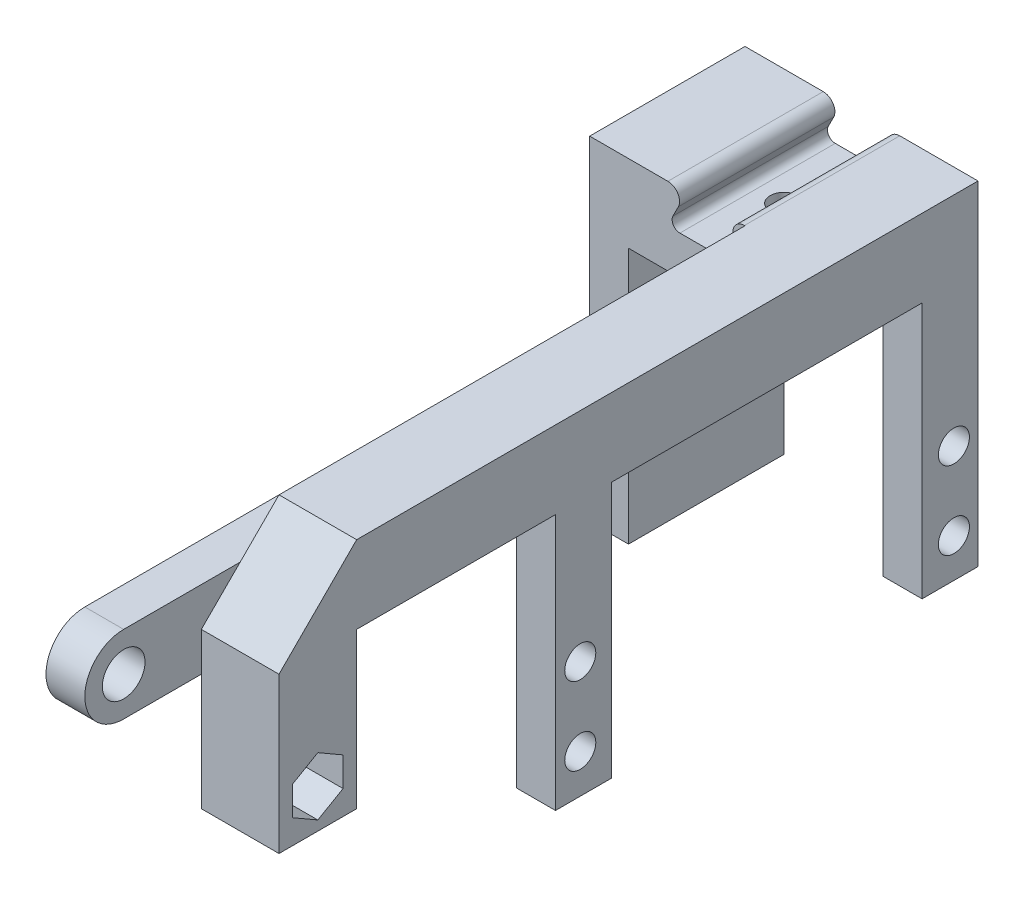
from build123d import *

# Parameters (mm, degrees)
RESSALTO_EXTRUS_O1_DEPTH = 80
ESBO_O2_W                = 40
ESBO_O2_H                = 33
ESBO_O2_W_2              = 25.6
CORTE_EXTRUS_O1_DEPTH    = 12
ESBO_O4_R                = 2
CORTE_EXTRUS_O3_DEPTH    = 12
ESBO_O6_W                = 10
ESBO_O6_H                = 20
RESSALTO_EXTRUS_O2_DEPTH = 10
ESBO_O7_R                = 1.75
CORTE_EXTRUS_O4_DEPTH    = 15
CORTE_EXTRUS_O5_DEPTH    = 5
ESBO_O10_R               = 5
ESBO_O10_R_2             = 2.75
RESSALTO_EXTRUS_O3_DEPTH = 5
ESBO_O11_W               = 20
ESBO_O11_H               = 20
ESBO_O11_W_2             = 25
ESBO_O11_H_2             = 10
CORTE_EXTRUS_O7_DEPTH    = 60
ESBO_O13_W               = 30
ESBO_O13_H               = 47
CORTE_EXTRUS_O9_DEPTH    = 168
FILETE1_R                = 1.5
ESBO_O14_R               = 1.75
CORTE_EXTRUS_O10_DEPTH   = 14.5
CORTE_EXTRUS_O11_DEPTH   = 2.5
FILETE2_R                = 1
ESBO_O16_W               = 30
ESBO_O16_H               = 43
CORTE_EXTRUS_O12_DEPTH   = 120


with BuildPart() as part:
    # Esboço1 → Ressalto-extrusão1 (new body)
    with BuildSketch(Plane.XY):
        Polygon((-2.5, 45), (-15, 45), (-15, 2), (-10, 2), (-10, 35), (10, 35), (10, -35), (-15, -35), (-15, -45), (15, -45), (15, 45), (2.5, 45), (5, 40), (-5, 40), align=None)
    extrude(amount=RESSALTO_EXTRUS_O1_DEPTH)

    # Esboço2 → Corte-extrusão1 (cut)
    with BuildSketch(Plane.ZY.offset(15)):
        with Locations((27.2, 18.5)):
            Rectangle(ESBO_O2_W, ESBO_O2_H)
        with Locations((67.2, 18.5)):
            Rectangle(ESBO_O2_W_2, ESBO_O2_H)
    extrude(amount=-CORTE_EXTRUS_O1_DEPTH, mode=Mode.SUBTRACT)

    # Esboço4 → Corte-extrusão3 (cut)
    with BuildSketch(Plane(origin=(-10, 0, 0), x_dir=(0, 0, -1), z_dir=(1, 0, 0))):
        with Locations(Location((-3.104223841, 17.002484575, 0), (0, 0, 90))):
            Circle(ESBO_O4_R)
        with Locations(Location((-3.104223841, 7.000828192, 0), (0, 0, 90))):
            Circle(ESBO_O4_R)
        with Locations(Location((-51.210481376, 17.002484575, 0), (0, 0, 90))):
            Circle(ESBO_O4_R)
        with Locations(Location((-51.210481376, 7.000828192, 0), (0, 0, 90))):
            Circle(ESBO_O4_R)
    extrude(amount=-CORTE_EXTRUS_O3_DEPTH, mode=Mode.SUBTRACT)

    # Esboço6 → Ressalto-extrusão2 (add)
    with BuildSketch(Plane.ZY.offset(15)):
        with Locations((85, 25)):
            Rectangle(ESBO_O6_W, ESBO_O6_H)
        Polygon((80, 35), (90, 35), (80, 45), align=None)
    extrude(amount=-RESSALTO_EXTRUS_O2_DEPTH)

    # Esboço7 → Corte-extrusão4 (cut)
    with BuildSketch(Plane.ZY.offset(15)):
        with Locations(Location((85, 20, 0), (0, 0, 270))):
            Circle(ESBO_O7_R)
    extrude(amount=-CORTE_EXTRUS_O4_DEPTH, mode=Mode.SUBTRACT)

    # Esboço8 → Corte-extrusão5 (cut)
    with BuildSketch(Plane.ZY.offset(15)):
        Polygon((85, 23.75277675), (81.75, 21.876388375), (81.75, 18.123611625), (85, 16.24722325), (88.25, 18.123611625), (88.25, 21.876388375), align=None)
    extrude(amount=-CORTE_EXTRUS_O5_DEPTH, mode=Mode.SUBTRACT)

    # Esboço10 → Ressalto-extrusão3 (add)
    # profile 1 of 3: a face of its own
    with BuildSketch(Plane(origin=(15, 0, 0), x_dir=(0, 0, -1), z_dir=(1, 0, 0))):
        with BuildLine():
            Line((-80, 25), (-85, 25))
            ThreePointArc((-85, 25), (-81.464466094, 23.535533906), (-80, 20))
            Line((-80, 20), (-80, 25))
        make_face()
    # profile 2 of 3: a face of its own
    with BuildSketch(Plane(origin=(15, 0, 0), x_dir=(0, 0, -1), z_dir=(1, 0, 0))):
        with Locations((-85, 20)):
            Circle(ESBO_O10_R)
        with Locations(Location((-85, 20, 0), (0, 0, 90))):
            Circle(ESBO_O10_R_2, mode=Mode.SUBTRACT)
    # profile 3 of 3: a face of its own
    with BuildSketch(Plane(origin=(15, 0, 0), x_dir=(0, 0, -1), z_dir=(1, 0, 0))):
        with BuildLine():
            Line((-80, 15), (-80, 20))
            ThreePointArc((-80, 20), (-81.464466094, 16.464466094), (-85, 15))
            Line((-85, 15), (-80, 15))
        make_face()
    extrude(amount=-RESSALTO_EXTRUS_O3_DEPTH)

    # Esboço11 → Corte-extrusão7 (cut)
    with BuildSketch(Plane.XY.offset(80)):
        with Locations((5, 35)):
            Rectangle(ESBO_O11_W, ESBO_O11_H)
        Polygon((10, -45), (15, -45), (15, 15), (10, 15), (10, -35), align=None)
        with Locations((-2.5, -40)):
            Rectangle(ESBO_O11_W_2, ESBO_O11_H_2)
    extrude(amount=-CORTE_EXTRUS_O7_DEPTH, mode=Mode.SUBTRACT)

    # Esboço13 → Corte-extrusão9 (cut)
    with BuildSketch(Plane.XY.offset(20)):
        with Locations((0, -21.5)):
            Rectangle(ESBO_O13_W, ESBO_O13_H)
    extrude(amount=-CORTE_EXTRUS_O9_DEPTH, mode=Mode.SUBTRACT)

    # Filete1
    filete1_edges = [part.edges().sort_by_distance(p)[0] for p in [
        (2.5, 45, 10),
        (-2.5, 45, 10),
    ]]
    fillet(filete1_edges, radius=FILETE1_R)

    # Esboço14 → Corte-extrusão10 (cut)
    with BuildSketch(Plane(origin=(0, 40, 0), x_dir=(1, 0, 0), z_dir=(0, 1, 0))):
        with Locations(Location((0, -10, 0), (0, 0, 270))):
            Circle(ESBO_O14_R)
    extrude(amount=-CORTE_EXTRUS_O10_DEPTH, mode=Mode.SUBTRACT)

    # Esboço15 → Corte-extrusão11 (cut)
    with BuildSketch(Plane.XZ.offset(-35)):
        Polygon((0, 13.75277675), (-3.25, 11.876388375), (-3.25, 8.123611625), (0, 6.24722325), (3.25, 8.123611625), (3.25, 11.876388375), align=None)
    extrude(amount=-CORTE_EXTRUS_O11_DEPTH, mode=Mode.SUBTRACT)

    # Filete2
    filete2_edges = [part.edges().sort_by_distance(p)[0] for p in [
        (-5, 40, 10),
        (5, 40, 10),
    ]]
    fillet(filete2_edges, radius=FILETE2_R)

    # Espelhar1: part across plane


with BuildPart() as part_1:
    add(part.part)
    add(part.part.mirror(Plane(origin=(-15, 0, 80), x_dir=(0, 0, 1), z_dir=(1, 0, 0))))

    # Esboço16 → Corte-extrusão12 (cut)
    with BuildSketch(Plane.XY.offset(90)):
        with Locations((0, 23.5)):
            Rectangle(ESBO_O16_W, ESBO_O16_H)
    extrude(amount=-CORTE_EXTRUS_O12_DEPTH, mode=Mode.SUBTRACT)


solid = part_1.part
